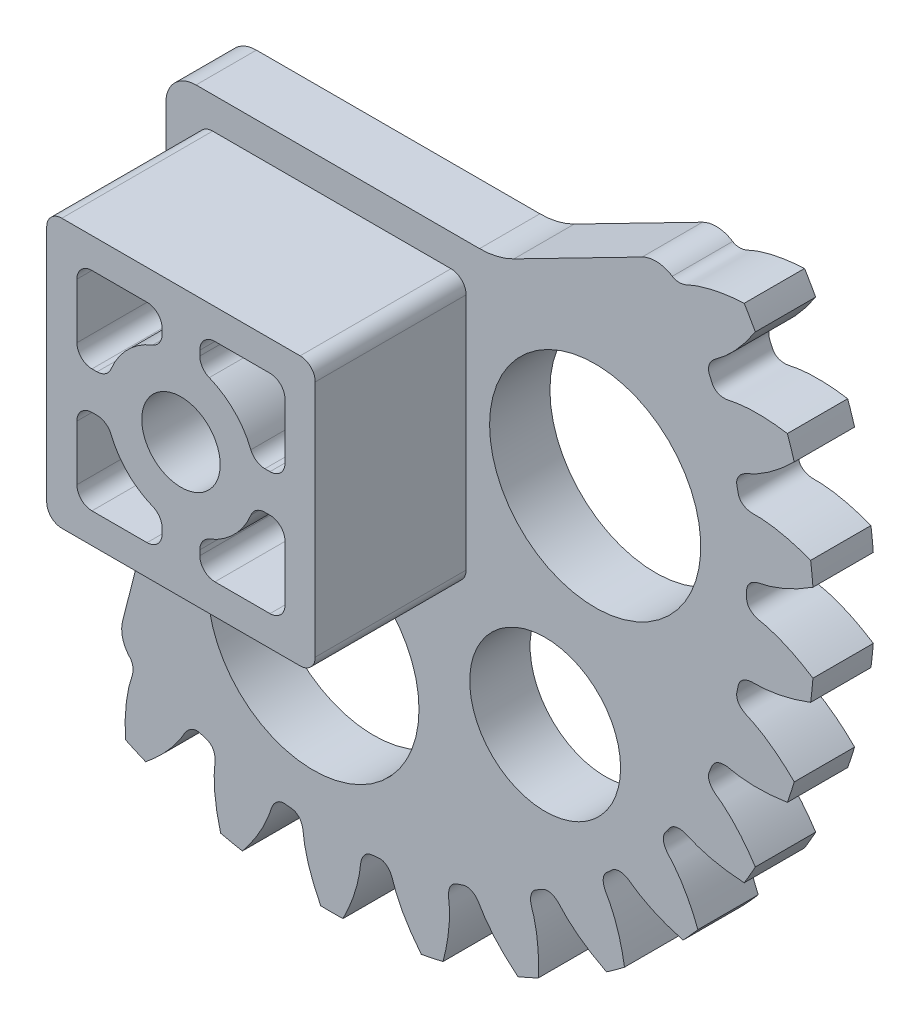
from build123d import *
from OCP.BRepFilletAPI import BRepFilletAPI_MakeFillet

# Parameters (mm, degrees)
SKETCH_376_W               = 4
SKETCH_376_H               = 31.999999519
CUT_EXTRUDE_567_DEPTH      = 46.354161204
PATTERN_CIRCULAR_616_COUNT = 30
CUT_EXTRUDE_3_DEPTH        = 46.356190833
SKETCH_11_W                = 17.8
SKETCH_11_H                = 17.8
EXTRUDE_1_DEPTH            = 10
SKETCH_12_R                = 2.6
CUT_EXTRUDE_6_DEPTH        = 48.298880123
CUT_EXTRUDE_8_DEPTH        = 48.298880123
SKETCH_15_R                = 5
SKETCH_15_R_2              = 7
CUT_EXTRUDE_9_DEPTH        = 47.272929897
FILLET_3_R                 = 1
FILLET_4_R1                = 2
FILLET_4_R2                = 5


with BuildPart() as part:
    # Sketch 376 → Revolve 434 (revolve)
    with BuildSketch(Plane(origin=(0, 0, 0), x_dir=(0, 0, -1), z_dir=(1, 0, 0))):
        with Locations((1, 15.99999976)):
            Rectangle(SKETCH_376_W, SKETCH_376_H)
    revolve(axis=Axis((0, 0, 0), (0, 0, -1)))

    # Sketch 482 → Cut-Extrude 567 (cut, symmetric)
    with BuildSketch(Plane.XY):
        with BuildLine():
            ThreePointArc((31.98852491, 2.672871703), (32.099999518, 0), (31.98852491, -2.672871703))
            add(Edge.make_bspline(
                [(31.98852491, -2.672871703), (31.767366867, -2.527342746), (31.438863587, -2.32308559), (31.002096806, -2.076272612), (30.697314959, -1.914820677), (30.406985463, -1.77099694), (30.131828281, -1.643888509), (29.872524506, -1.532554955), (29.62971407, -1.436036346), (29.403999642, -1.353334354), (29.195930403, -1.283480458), (29.006051638, -1.225320778), (28.834742818, -1.178212428), (28.604717546, -1.120141733), (28.409252952, -1.088701411), (28.250643065, -1.044900273), (28.195381298, -1.027812852), (28.141253551, -1.009091948), (28.08811483, -0.988565013), (28.035802025, -0.965993069), (27.984140167, -0.941063783), (27.932950417, -0.913367424), (27.882067455, -0.882371802), (27.831370716, -0.847393345), (27.780837777, -0.807570355), (27.730629823, -0.761849557), (27.681217999, -0.709009062), (27.63354881, -0.647755497), (27.589216855, -0.576947809), (27.550559225, -0.495974909), (27.520525419, -0.405286667), (27.503201765, -0.312156465), (27.496002602, -0.176105412), (27.502866879, 0), (27.496002602, 0.176105412), (27.503201765, 0.312156465), (27.520525419, 0.405286667), (27.550559225, 0.495974909), (27.589216855, 0.576947809), (27.63354881, 0.647755497), (27.681217999, 0.709009062), (27.730629823, 0.761849557), (27.780837777, 0.807570355), (27.831370716, 0.847393345), (27.882067455, 0.882371802), (27.932950417, 0.913367424), (27.984140167, 0.941063783), (28.035802025, 0.965993069), (28.08811483, 0.988565013), (28.141253551, 1.009091948), (28.195381298, 1.027812852), (28.250643065, 1.044900273), (28.409252952, 1.088701411), (28.604717546, 1.120141733), (28.834742818, 1.178212428), (29.006051638, 1.225320778), (29.195930403, 1.283480458), (29.403999642, 1.353334354), (29.62971407, 1.436036346), (29.872524506, 1.532554955), (30.131828281, 1.643888509), (30.406985463, 1.77099694), (30.697314959, 1.914820677), (31.002096806, 2.076272612), (31.438863587, 2.32308559), (31.767366867, 2.527342746), (31.98852491, 2.672871703)],
                knots=[0, 0, 0, 0, 0.071865675, 0.104961709, 0.136166541, 0.165480172, 0.1929026, 0.218433827, 0.242073852, 0.263822675, 0.283680296, 0.301646715, 0.317721932, 0.331905947, 0.366034352, 0.371334023, 0.376560671, 0.381734146, 0.3868781, 0.392020792, 0.397196045, 0.402444319, 0.407813848, 0.413361641, 0.419153999, 0.425265839, 0.431777669, 0.438768527, 0.446303002, 0.454411516, 0.463066602, 0.472163953, 0.480031429, 0.5, 0.519968571, 0.527836047, 0.536933398, 0.545588484, 0.553696998, 0.561231473, 0.568222331, 0.574734161, 0.580846001, 0.586638359, 0.592186152, 0.597555681, 0.602803955, 0.607979208, 0.6131219, 0.618265854, 0.623439329, 0.628665977, 0.633965648, 0.668094053, 0.682278068, 0.698353285, 0.716319704, 0.736177325, 0.757926148, 0.781566173, 0.8070974, 0.834519828, 0.863833459, 0.895038291, 0.928134325, 1, 1, 1, 1], degree=3))
        make_face()
    cut_extrude_567 = extrude(amount=CUT_EXTRUDE_567_DEPTH, both=True, mode=Mode.SUBTRACT)

    # Pattern Circular 616: Cut-Extrude 567 ×30 about axis
    pattern_circular_616_axis = Axis((0, 0, 55), (0, 0, -1))
    for i in range(1, PATTERN_CIRCULAR_616_COUNT):
        add(cut_extrude_567.rotate(pattern_circular_616_axis, i * 360 / PATTERN_CIRCULAR_616_COUNT), mode=Mode.SUBTRACT)

    # 草图5 → 切除-拉伸3 (cut, through all)
    with BuildSketch(Plane.XY.offset(1)):
        Polygon((-36.984816405, -25.448277273), (-36.984816405, 35.190616991), (27.336788896, 35.190616991), (27.336788896, 16.634300168), (-16.1, 16.634300168), (-16.1, 10), (-16.1, -32.995103302), align=None)
    extrude(amount=-CUT_EXTRUDE_3_DEPTH, mode=Mode.SUBTRACT)

    # 草图11 → 凸台-拉伸1 (add)
    with BuildSketch(Plane.XY.offset(1)):
        Rectangle(SKETCH_11_W, SKETCH_11_H)
    extrude(amount=EXTRUDE_1_DEPTH)

    # 草图12 → 切除-拉伸6 (cut, through all)
    with BuildSketch(Plane.XY.offset(11)):
        Circle(SKETCH_12_R)
    extrude(amount=-CUT_EXTRUDE_6_DEPTH, mode=Mode.SUBTRACT)

    # 草图13 → 切除-拉伸8 (cut, through all)
    with BuildSketch(Plane.XY.offset(11)):
        with BuildLine():
            Line((6.9, -6.9), (6.9, -1.25))
            Line((6.9, -1.25), (4.841229183, -1.25))
            ThreePointArc((4.841229183, -1.25), (3.535533906, -3.535533906), (1.25, -4.841229183))
            Line((1.25, -4.841229183), (1.25, -6.9))
            Line((1.25, -6.9), (6.9, -6.9))
        make_face()
        with BuildLine():
            Line((4.841229183, 1.25), (6.9, 1.25))
            Line((6.9, 1.25), (6.9, 6.9))
            Line((6.9, 6.9), (1.25, 6.9))
            Line((1.25, 6.9), (1.25, 4.841229183))
            ThreePointArc((1.25, 4.841229183), (3.535533906, 3.535533906), (4.841229183, 1.25))
        make_face()
        with BuildLine():
            Line((-1.25, -6.9), (-1.25, -4.841229183))
            ThreePointArc((-1.25, -4.841229183), (-3.535533906, -3.535533906), (-4.841229183, -1.25))
            Line((-4.841229183, -1.25), (-6.9, -1.25))
            Line((-6.9, -1.25), (-6.9, -6.9))
            Line((-6.9, -6.9), (-1.25, -6.9))
        make_face()
        with BuildLine():
            ThreePointArc((-4.841229183, 1.25), (-3.535533906, 3.535533906), (-1.25, 4.841229183))
            Line((-1.25, 4.841229183), (-1.25, 6.9))
            Line((-1.25, 6.9), (-6.9, 6.9))
            Line((-6.9, 6.9), (-6.9, 1.25))
            Line((-6.9, 1.25), (-4.841229183, 1.25))
        make_face()
    extrude(amount=-CUT_EXTRUDE_8_DEPTH, mode=Mode.SUBTRACT)

    # 草图15 → 切除-拉伸9 (cut, through all)
    with BuildSketch(Plane.XY.offset(1)):
        with Locations((14.142135624, -14.142135624)):
            Circle(SKETCH_15_R)
        with Locations((-1.220738291, -17.45737088)):
            Circle(SKETCH_15_R_2)
        with Locations((17.45737088, 1.220738291)):
            Circle(SKETCH_15_R_2)
        with BuildLine():
            Line((-16.1, 16.634300168), (21.99057904, 16.634300168))
            Line((21.99057904, 16.634300168), (11, 11))
            Line((11, 11), (-11, 11))
            Line((-11, 11), (-11, -11))
            Line((-11, -11), (-14.228798167, -23.610428925))
            add(Edge.make_bspline(
                [(-14.228798167, -23.610428925), (-14.251252569, -23.607963584), (-14.301564242, -23.604750251), (-14.377747121, -23.607477518), (-14.454628859, -23.618133464), (-14.525095982, -23.634505111), (-14.589795331, -23.655126076), (-14.649549522, -23.67897739), (-14.705190124, -23.705392826), (-14.757474601, -23.733960952), (-14.807055226, -23.764444396), (-14.85447555, -23.796720235), (-14.90017983, -23.830738481), (-14.944526038, -23.866494496), (-14.987802689, -23.904010047), (-15.030231714, -23.943324431), (-15.147469555, -24.058784053), (-15.27242997, -24.212341197), (-15.437733303, -24.382513578), (-15.56418474, -24.507317193), (-15.709491883, -24.642677187), (-15.874021751, -24.787943486), (-16.006854896, -24.898919118), (-16.084564151, -24.9617296), (-16.1, -24.974125598)],
                knots=[0.547568735, 0.547568735, 0.547568735, 0.547568735, 0.553696998, 0.561231473, 0.568222331, 0.574734161, 0.580846001, 0.586638359, 0.592186152, 0.597555681, 0.602803955, 0.607979208, 0.6131219, 0.618265854, 0.623439329, 0.628665977, 0.633965648, 0.668094053, 0.682278068, 0.698353285, 0.716319704, 0.736177325, 0.757926148, 0.763300024, 0.763300024, 0.763300024, 0.763300024], degree=3))
            Line((-16.1, -24.974125598), (-16.1, 16.634300168))
        make_face()
    extrude(amount=-CUT_EXTRUDE_9_DEPTH, mode=Mode.SUBTRACT)

    # 圆角3
    fillet_3_edges = [part.edges().sort_by_distance(p)[0] for p in [
        (4.841229183, -1.25, 4),
        (6.9, -1.25, 4),
        (6.9, -6.9, 4),
        (1.25, -6.9, 4),
        (1.25, -4.841229183, 4),
        (-4.841229183, 1.25, 4),
        (-6.9, 1.25, 4),
        (-6.9, 6.9, 4),
        (-1.25, 6.9, 4),
        (-1.25, 4.841229183, 4),
        (-1.25, -4.841229183, 4),
        (-1.25, -6.9, 4),
        (-6.9, -6.9, 4),
        (-6.9, -1.25, 4),
        (1.25, 4.841229183, 4),
        (1.25, 6.9, 4),
        (6.9, 6.9, 4),
        (6.9, 1.25, 4),
        (4.841229183, 1.25, 4),
        (-4.841229183, -1.25, 4),
        (8.9, -8.9, 6),
        (-8.9, 8.9, 6),
        (8.9, 8.9, 6),
        (-8.9, -8.9, 6),
    ]]
    fillet(fillet_3_edges, radius=FILLET_3_R)

    # 圆角4: one fillet with a radius per group of edges: ONE call of the kernel's fillet builder (fillet() takes one radius for all edges)
    fillet_4_edges_1 = [part.edges().sort_by_distance(p)[0] for p in [
        (-11, 11, -1),
        (21.990579039, 16.634300168, -1.5),
        (-14.228798167, -23.610428925, -1.5),
    ]]
    fillet_4_edges_2 = [part.edges().sort_by_distance(p)[0] for p in [
        (11, 11, -1),
        (-11, -11, -1),
    ]]
    fillet_4 = BRepFilletAPI_MakeFillet(part.part.solid().wrapped)
    for e in fillet_4_edges_1:
        fillet_4.Add(FILLET_4_R1, e.wrapped)
    for e in fillet_4_edges_2:
        fillet_4.Add(FILLET_4_R2, e.wrapped)
    add(Compound.cast(fillet_4.Shape()), mode=Mode.REPLACE)


solid = part.part
